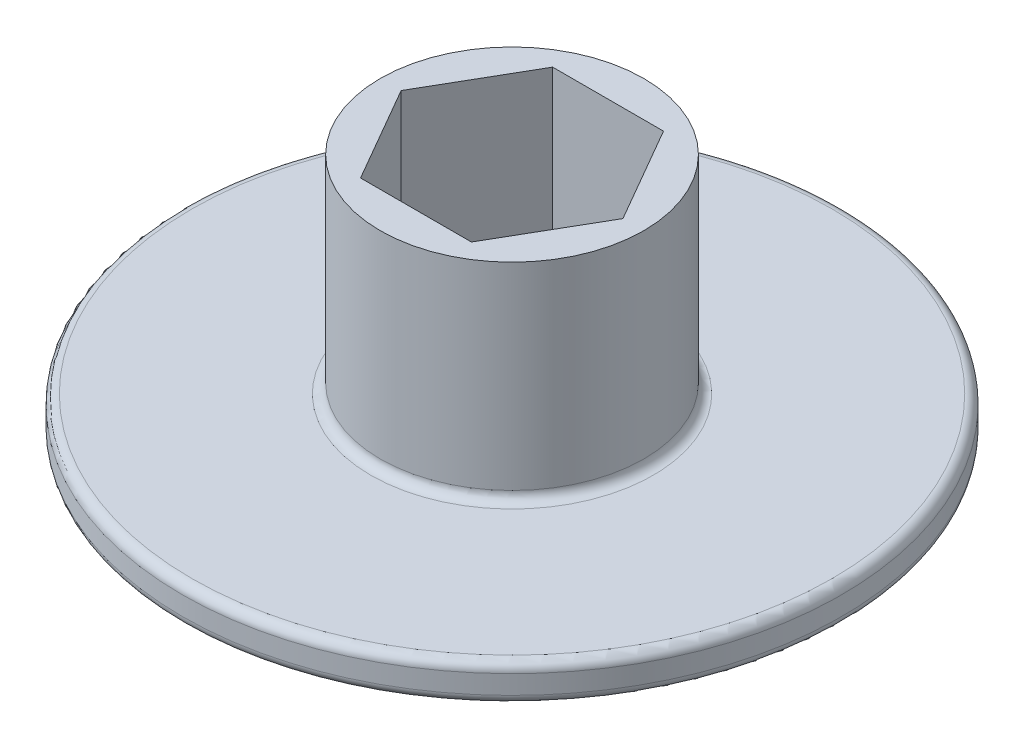
from build123d import *

# Parameters (mm, degrees)
SKETCH1_R           = 22.225
BOSS_EXTRUDE1_DEPTH = 2.54
SKETCH2_R           = 8.89
BOSS_EXTRUDE2_DEPTH = 13.97
FILLET1_R           = 0.635


with BuildPart() as part:
    # Sketch1 → Boss-Extrude1 (new body)
    with BuildSketch(Plane(origin=(0, 0, 0), x_dir=(1, 0, 0), z_dir=(0, 1, 0))):
        with Locations(Location((0, 0, 0), (0, 0, 270))):
            Circle(SKETCH1_R)
        Polygon((7.478995387, 0), (3.739497694, 6.477), (-3.739497694, 6.477), (-7.478995387, 0), (-3.739497694, -6.477), (3.739497694, -6.477), align=None, mode=Mode.SUBTRACT)
    extrude(amount=BOSS_EXTRUDE1_DEPTH)

    # Sketch2 → Boss-Extrude2 (add)
    with BuildSketch(Plane(origin=(0, 2.54, 0), x_dir=(1, 0, 0), z_dir=(0, 1, 0))):
        with Locations(Location((0, 0, 0), (0, 0, 270))):
            Circle(SKETCH2_R)
        Polygon((3.739497694, 6.477), (-3.739497694, 6.477), (-7.478995387, 0), (-3.739497694, -6.477), (3.739497694, -6.477), (7.478995387, 0), align=None, mode=Mode.SUBTRACT)
    extrude(amount=BOSS_EXTRUDE2_DEPTH)

    # Fillet1
    fillet1_edges = [part.edges().sort_by_distance(p)[0] for p in [
        (0, 0, -6.477),
        (-5.60924654, 0, -3.2385),
        (-5.60924654, 0, 3.2385),
        (0, 0, 6.477),
        (0, 0, -22.225),
        (0, 2.54, -8.89),
        (0, 2.54, -22.225),
        (5.60924654, 0, 3.2385),
        (5.60924654, 0, -3.2385),
    ]]
    fillet(fillet1_edges, radius=FILLET1_R)


solid = part.part
